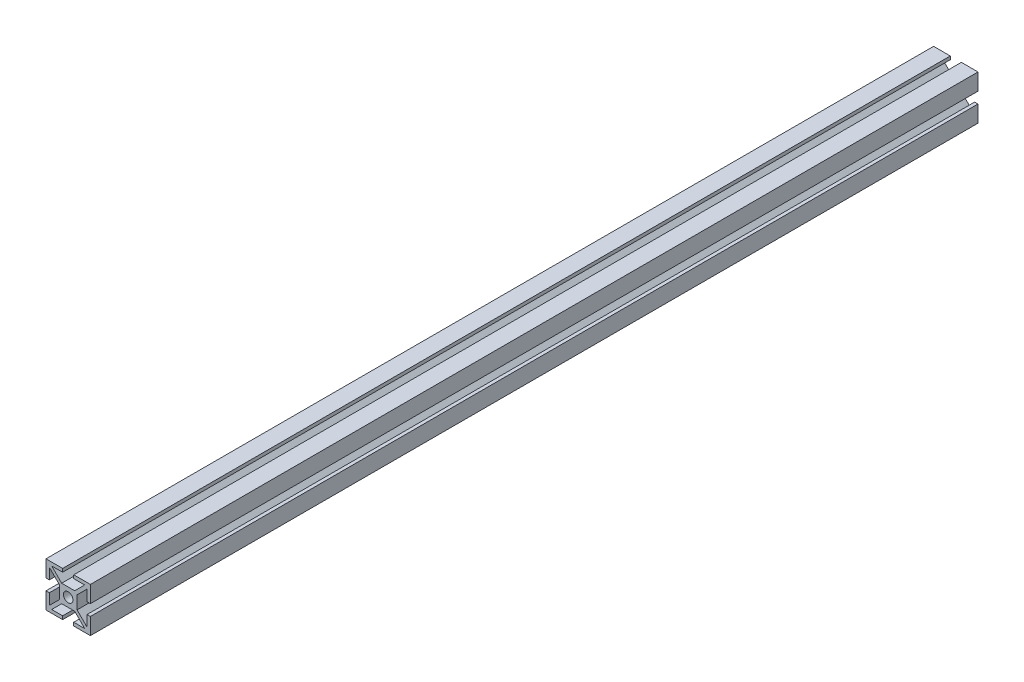
from build123d import *

# Parameters (mm, degrees)
SKIZZE2_R                       = 2.15
AUFSATZ_LINEAR_AUSTRAGEN1_DEPTH = 400


with BuildPart() as part:
    # Skizze2 → Aufsatz-Linear austragen1 (new body)
    with BuildSketch(Plane.XY):
        Polygon((-10, -2.5), (-10, -10), (-2.5, -10), (-2.5, -8.5), (-7.439339828, -8.5), (-2.939339828, -4), (2.939339828, -4), (7.439339828, -8.5), (2.5, -8.5), (2.5, -10), (10, -10), (10, -2.5), (8.495523259, -2.5), (8.495523259, -7.434863087), (4, -2.939339828), (4, 2.939339828), (8.495523259, 7.434863087), (8.495523259, 2.5), (10, 2.5), (10, 10), (2.5, 10), (2.5, 8.5), (7.439339828, 8.5), (2.939339828, 4), (-2.939339828, 4), (-7.439339828, 8.5), (-2.5, 8.5), (-2.5, 10), (-10, 10), (-10, 2.5), (-8.5, 2.5), (-8.5, 7.439339828), (-4, 2.939339828), (-4, -2.939339828), (-8.5, -7.439339828), (-8.5, -2.5), align=None)
        Circle(SKIZZE2_R, mode=Mode.SUBTRACT)
    extrude(amount=AUFSATZ_LINEAR_AUSTRAGEN1_DEPTH)


solid = part.part
